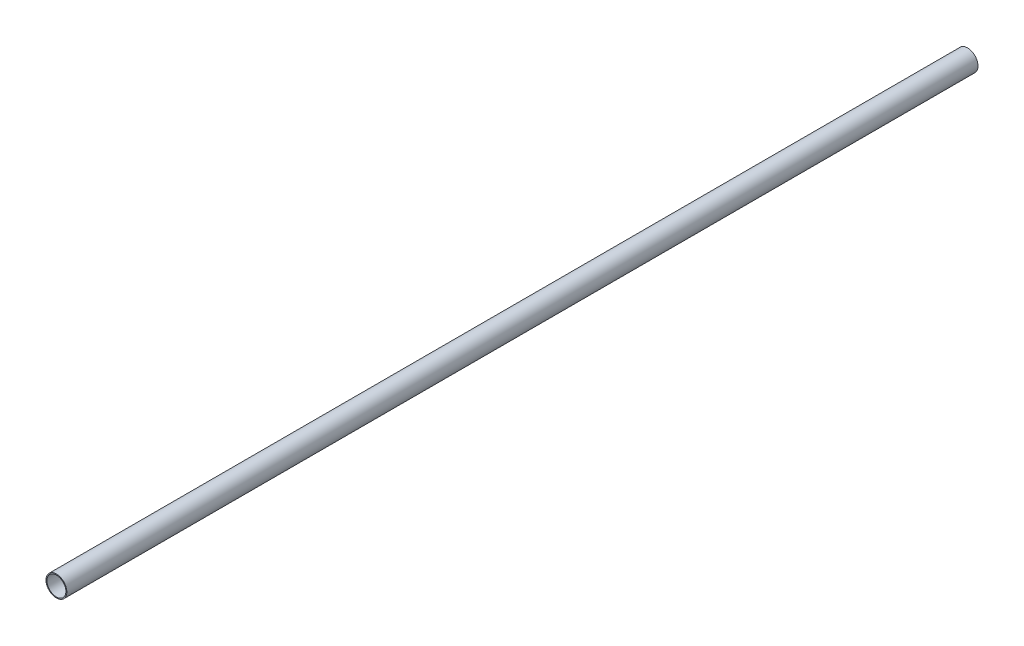
from build123d import *

# Parameters (mm, degrees)
SKETCH1_R           = 11
SKETCH1_R_2         = 10
BOSS_EXTRUDE1_DEPTH = 961


with BuildPart() as part:
    # Sketch1 → Boss-Extrude1 (new body)
    with BuildSketch(Plane.XY):
        Circle(SKETCH1_R)
        Circle(SKETCH1_R_2, mode=Mode.SUBTRACT)
    extrude(amount=BOSS_EXTRUDE1_DEPTH)


solid = part.part
